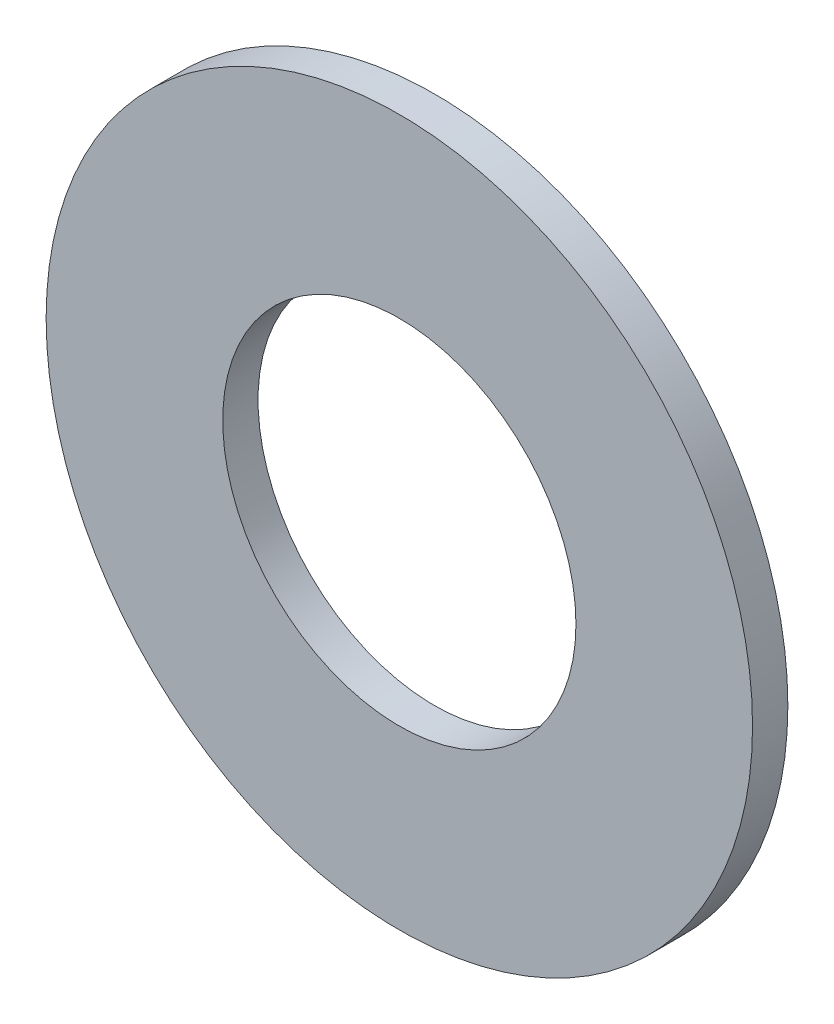
from build123d import *

# Parameters (mm, degrees)
SKETCH_1_R      = 20
SKETCH_1_R_2    = 10
EXTRUDE_1_DEPTH = 2


with BuildPart() as part:
    # Эскиз1 → Вытянуть1 (new body)
    with BuildSketch(Plane.XY):
        Circle(SKETCH_1_R)
        Circle(SKETCH_1_R_2, mode=Mode.SUBTRACT)
    extrude(amount=EXTRUDE_1_DEPTH)


solid = part.part
